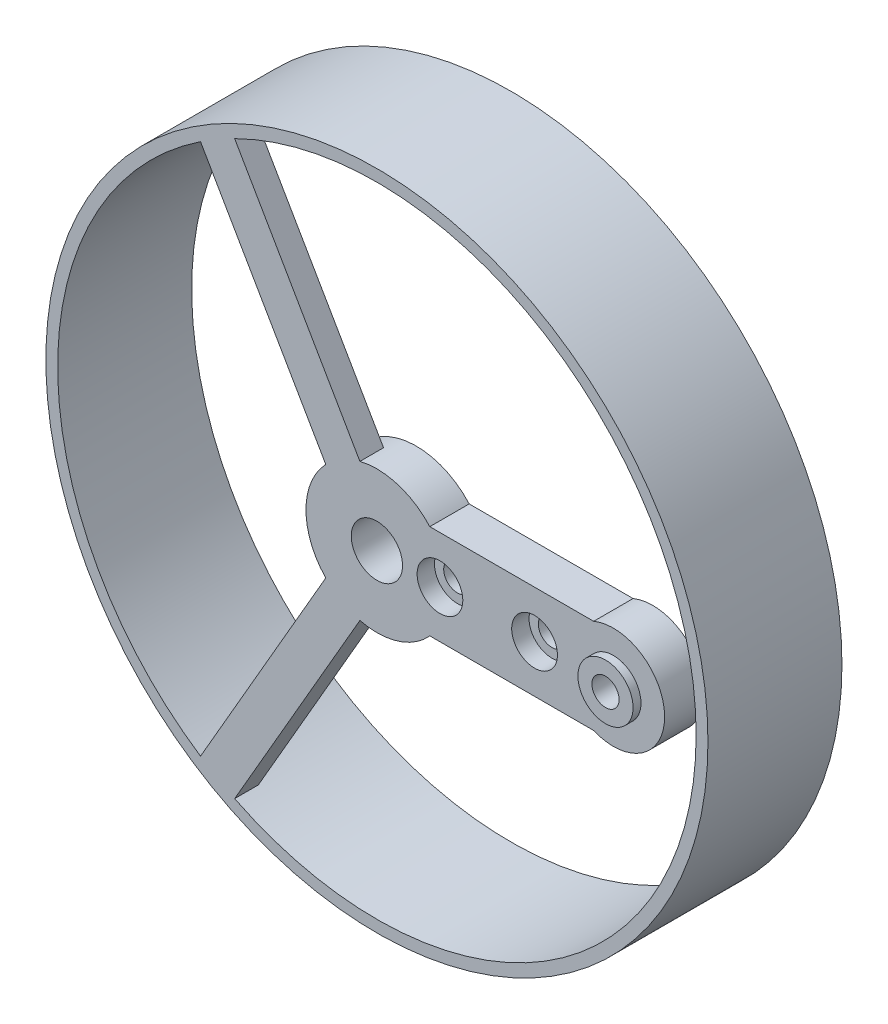
from build123d import *

# Parameters (mm, degrees)
BOSS_EXTRUDE1_START     = -9
SKETCH1_W               = 30
SKETCH1_H               = 12
BOSS_EXTRUDE1_DEPTH     = 5
BOSS_EXTRUDE2_START     = -9
SKETCH2_R               = 9
BOSS_EXTRUDE2_DEPTH     = 5
BOSS_EXTRUDE3_START     = -9
SKETCH3_R               = 6.5
BOSS_EXTRUDE3_DEPTH     = 5
CUT_EXTRUDE1_DEPTH      = 39.655530005
CUT_EXTRUDE1_DEPTH_BACK = 39.655530005
SKETCH4_R               = 3.25
CUT_EXTRUDE2_DEPTH      = 39.655530005
CUT_EXTRUDE2_DEPTH_BACK = 39.655530005
SKETCH5_R               = 1.725
CUT_EXTRUDE3_START      = -6.2
SKETCH6_R               = 2.9
CUT_EXTRUDE3_DEPTH      = 2.2
CUT_EXTRUDE4_START      = -6.2
SKETCH7_R               = 2.9
CUT_EXTRUDE4_DEPTH      = 2.2
CUT_EXTRUDE5_START      = -9
SKETCH8_R               = 2.9
CUT_EXTRUDE5_DEPTH      = 2.2
BOSS_EXTRUDE4_START     = -4
SKETCH9_R               = 3.5
BOSS_EXTRUDE4_DEPTH     = 1
CUT_EXTRUDE6_DEPTH      = 39.655530005
CUT_EXTRUDE6_DEPTH_BACK = 39.655530005
SKETCH10_R              = 1.725
BOSS_EXTRUDE5_START     = -21
SKETCH11_R              = 42
SKETCH11_R_2            = 40.5
BOSS_EXTRUDE5_DEPTH     = 17
BOSS_EXTRUDE6_START     = -7
BOSS_EXTRUDE6_DEPTH     = 3


with BuildPart() as part:
    # Sketch1 → Boss-Extrude1 (new body)
    with BuildSketch(Plane.XY.offset(BOSS_EXTRUDE1_START)):
        with Locations((15, 0)):
            Rectangle(SKETCH1_W, SKETCH1_H)
    extrude(amount=BOSS_EXTRUDE1_DEPTH)

    # Sketch2 → Boss-Extrude2 (add)
    with BuildSketch(Plane.XY.offset(BOSS_EXTRUDE2_START)):
        Circle(SKETCH2_R)
    extrude(amount=BOSS_EXTRUDE2_DEPTH)

    # Sketch3 → Boss-Extrude3 (add)
    with BuildSketch(Plane.XY.offset(BOSS_EXTRUDE3_START)):
        with Locations((30, 0)):
            Circle(SKETCH3_R)
    extrude(amount=BOSS_EXTRUDE3_DEPTH)

    # Sketch4 → Cut-Extrude1 (cut, two sides: drawn at the far end of the back side and taken through both)
    with BuildSketch(Plane.XY.offset(-CUT_EXTRUDE1_DEPTH_BACK)):
        Circle(SKETCH4_R)
    extrude(amount=CUT_EXTRUDE1_DEPTH + CUT_EXTRUDE1_DEPTH_BACK, mode=Mode.SUBTRACT)

    # Sketch5 → Cut-Extrude2 (cut, two sides: drawn at the far end of the back side and taken through both)
    with BuildSketch(Plane.XY.offset(-CUT_EXTRUDE2_DEPTH_BACK)):
        with Locations((8, 0)):
            Circle(SKETCH5_R)
        with Locations((20, 0)):
            Circle(SKETCH5_R)
        with Locations((30, 0)):
            Circle(SKETCH5_R)
    extrude(amount=CUT_EXTRUDE2_DEPTH + CUT_EXTRUDE2_DEPTH_BACK, mode=Mode.SUBTRACT)

    # Sketch6 → Cut-Extrude3 (cut)
    with BuildSketch(Plane.XY.offset(CUT_EXTRUDE3_START)):
        with Locations((8, 0)):
            Circle(SKETCH6_R)
    extrude(amount=CUT_EXTRUDE3_DEPTH, mode=Mode.SUBTRACT)

    # Sketch7 → Cut-Extrude4 (cut)
    with BuildSketch(Plane.XY.offset(CUT_EXTRUDE4_START)):
        with Locations((20, 0)):
            Circle(SKETCH7_R)
    extrude(amount=CUT_EXTRUDE4_DEPTH, mode=Mode.SUBTRACT)

    # Sketch8 → Cut-Extrude5 (cut)
    with BuildSketch(Plane.XY.offset(CUT_EXTRUDE5_START)):
        with Locations((30, 0)):
            Circle(SKETCH8_R)
    extrude(amount=CUT_EXTRUDE5_DEPTH, mode=Mode.SUBTRACT)

    # Sketch9 → Boss-Extrude4 (add)
    with BuildSketch(Plane.XY.offset(BOSS_EXTRUDE4_START)):
        with Locations((30, 0)):
            Circle(SKETCH9_R)
    extrude(amount=BOSS_EXTRUDE4_DEPTH)

    # Sketch10 → Cut-Extrude6 (cut, two sides: drawn at the far end of the back side and taken through both)
    with BuildSketch(Plane.XY.offset(-CUT_EXTRUDE6_DEPTH_BACK)):
        with Locations((30, 0)):
            Circle(SKETCH10_R)
    extrude(amount=CUT_EXTRUDE6_DEPTH + CUT_EXTRUDE6_DEPTH_BACK, mode=Mode.SUBTRACT)



with BuildPart() as body_2:
    # Sketch11 → Boss-Extrude5 (new body)
    with BuildSketch(Plane.XY.offset(BOSS_EXTRUDE5_START)):
        Circle(SKETCH11_R)
        Circle(SKETCH11_R_2, mode=Mode.SUBTRACT)
    extrude(amount=BOSS_EXTRUDE5_DEPTH)


with BuildPart() as part_1:
    add(part.part)

    add(body_2.part)  # Boss-Extrude6 merges body 2
    # Sketch12 → Boss-Extrude6 (add)
    with BuildSketch(Plane.XY.offset(BOSS_EXTRUDE6_START)):
        Polygon((-1.334936491, 7.312177826), (-18.584936491, 37.190054257), (-22.915063509, 34.690054257), (-5.665063509, 4.812177826), align=None)
        Polygon((-5.665063509, -4.812177826), (-22.915063509, -34.690054257), (-18.584936491, -37.190054257), (-1.334936491, -7.312177826), align=None)
    extrude(amount=BOSS_EXTRUDE6_DEPTH)


solid = part_1.part
